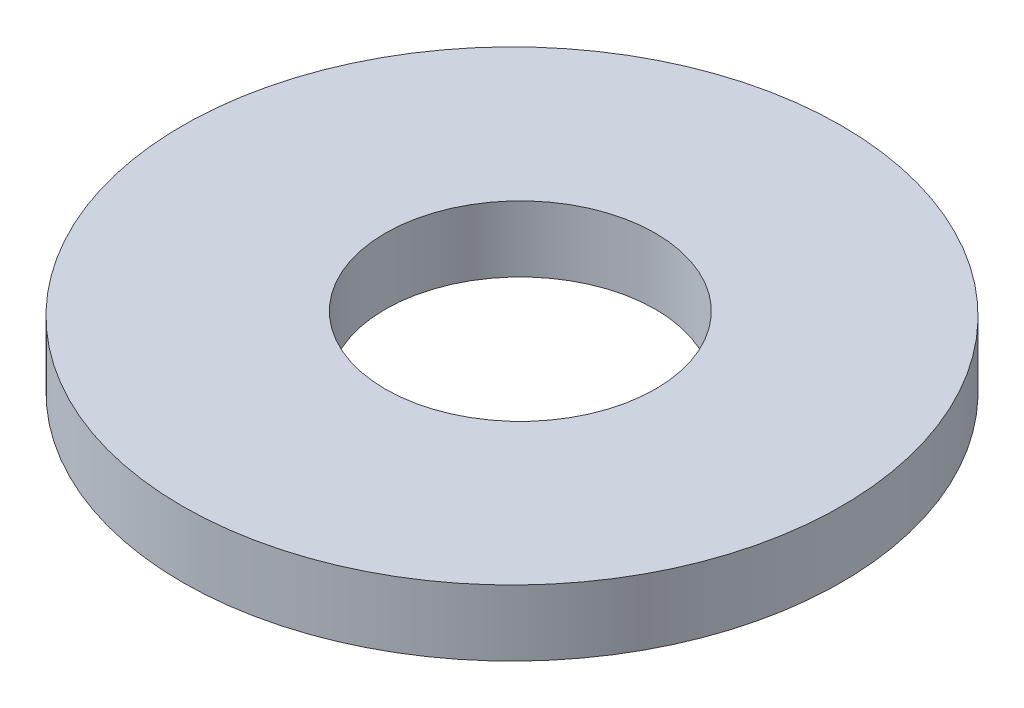
from build123d import *

# Parameters (mm, degrees)
SKETCH1_R           = 50
BOSS_EXTRUDE1_DEPTH = 10
SKETCH2_R           = 20.492416953
CUT_EXTRUDE1_DEPTH  = 72.414284285


with BuildPart() as part:
    # Sketch1 → Boss-Extrude1 (new body)
    with BuildSketch(Plane(origin=(0, 0, 0), x_dir=(1, 0, 0), z_dir=(0, 1, 0))):
        with Locations(Location((0, 0, 0), (0, 0, 270))):
            Circle(SKETCH1_R)
    extrude(amount=BOSS_EXTRUDE1_DEPTH)

    # Sketch2 → Cut-Extrude1 (cut, through all)
    with BuildSketch(Plane(origin=(0, 10, 0), x_dir=(1, 0, 0), z_dir=(0, 1, 0))):
        with Locations(Location((0, 1.265646581, 0), (0, 0, 270))):
            Circle(SKETCH2_R)
    extrude(amount=-CUT_EXTRUDE1_DEPTH, mode=Mode.SUBTRACT)


solid = part.part
